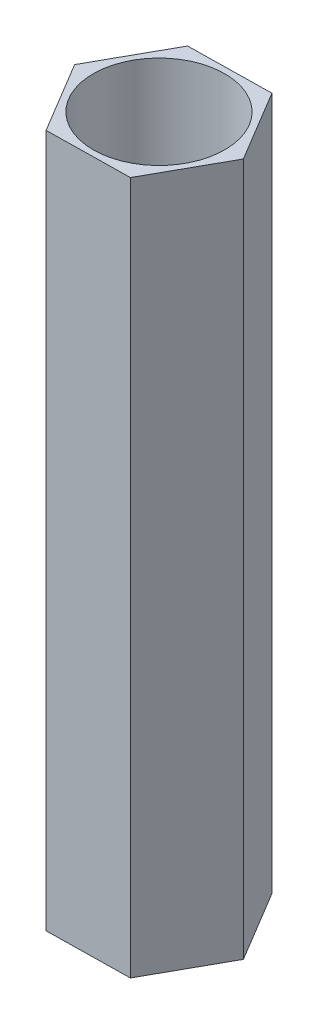
from build123d import *

# Parameters (mm, degrees)
BOSS_EXTRUDE1_DEPTH = 20
SKETCH2_R           = 1.9
CUT_EXTRUDE1_DEPTH  = 7.5
CUT_EXTRUDE2_START  = -7.5
SKETCH3_R           = 1.9
CUT_EXTRUDE2_DEPTH  = 7.5


with BuildPart() as part:
    # Sketch1 → Boss-Extrude1 (new body)
    with BuildSketch(Plane(origin=(0, 0, 0), x_dir=(1, 0, 0), z_dir=(0, 1, 0))):
        Polygon((1.231025405, -2.055580158), (2.395697339, 0.038309195), (1.164671934, 2.093889353), (-1.231025405, 2.055580158), (-2.395697339, -0.038309195), (-1.164671934, -2.093889353), align=None)
    extrude(amount=BOSS_EXTRUDE1_DEPTH)

    # Sketch2 → Cut-Extrude1 (cut)
    with BuildSketch(Plane(origin=(0, 20, 0), x_dir=(1, 0, 0), z_dir=(0, 1, 0))):
        with Locations(Location((0, 0, 0), (0, 0, 270))):
            Circle(SKETCH2_R)
    extrude(amount=-CUT_EXTRUDE1_DEPTH, mode=Mode.SUBTRACT)

    # Sketch3 → Cut-Extrude2 (cut)
    with BuildSketch(Plane.XZ.offset(CUT_EXTRUDE2_START)):
        with Locations(Location((0, 0, 0), (0, 0, 90))):
            Circle(SKETCH3_R)
    extrude(amount=CUT_EXTRUDE2_DEPTH, mode=Mode.SUBTRACT)


solid = part.part
